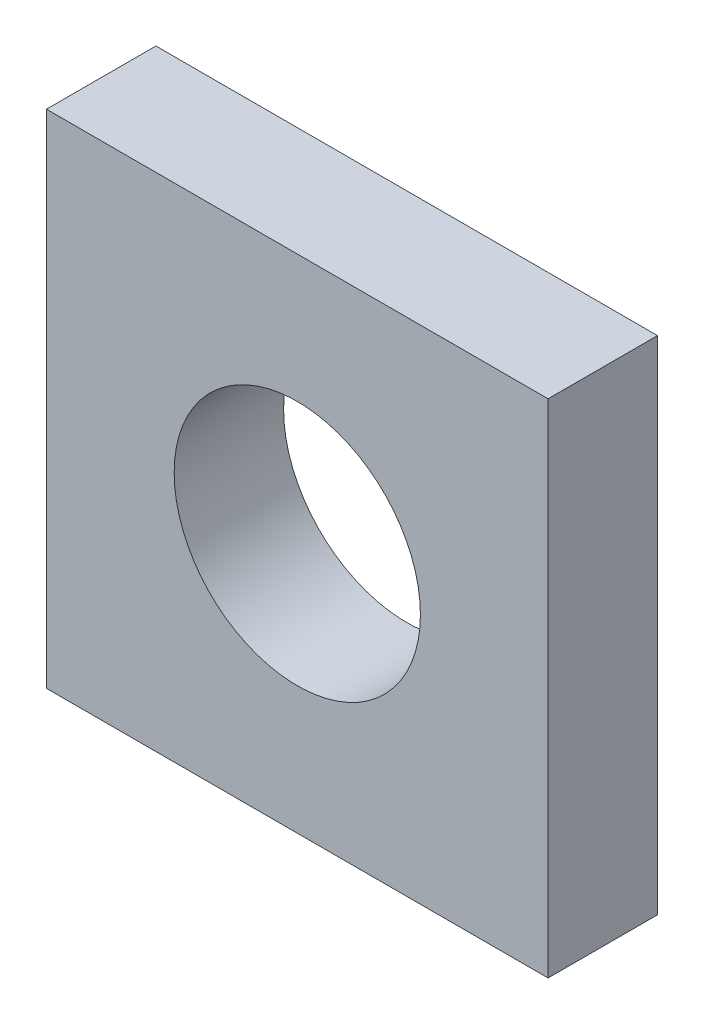
from build123d import *

# Parameters (mm, degrees)
ESBO_O1_W                = 5.5
ESBO_O1_H                = 5.5
ESBO_O1_R                = 1.35
RESSALTO_EXTRUS_O1_DEPTH = 0.6


with BuildPart() as part:
    # Esboço1 → Ressalto-extrusão1 (new, symmetric)
    with BuildSketch(Plane.XY):
        Rectangle(ESBO_O1_W, ESBO_O1_H)
        Circle(ESBO_O1_R, mode=Mode.SUBTRACT)
    extrude(amount=RESSALTO_EXTRUS_O1_DEPTH, both=True)


solid = part.part
